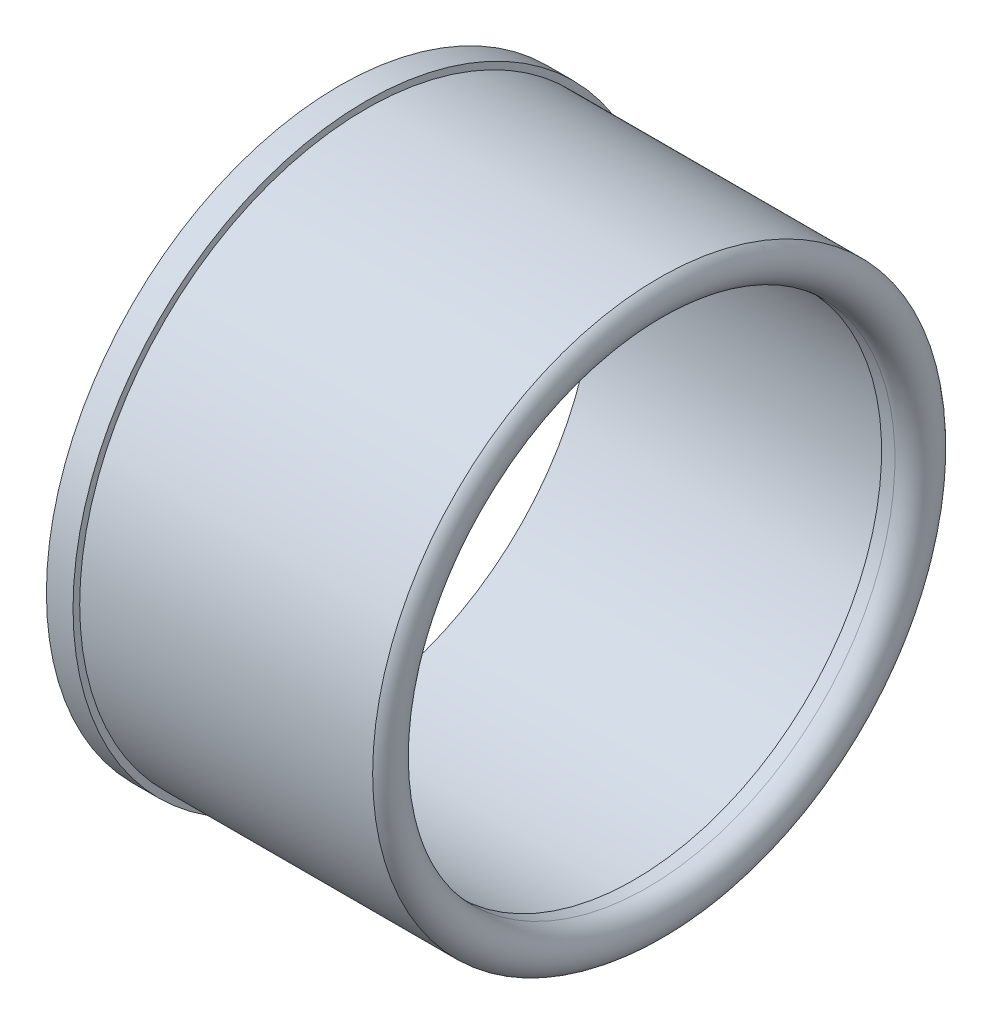
from build123d import *


with BuildPart() as part:
    # Sketch1 → Revolve1 (revolve)
    with BuildSketch(Plane(origin=(0, 0, 0), x_dir=(-1, 0, 0), z_dir=(0, 0, -1)), mode=Mode.PRIVATE) as revolve1_sk:
        with BuildLine():
            Line((-11.972812665, 0.766736765), (-11.972812665, 1.016736765))
            Line((-11.972812665, 1.016736765), (-0.912123334, 1.016736765))
            Line((-0.912123334, 1.016736765), (-0.912123334, 2.466736765))
            Line((-0.912123334, 2.466736765), (-1.912123334, 2.466736765))
            Line((-1.912123334, 2.466736765), (-1.912123334, 2.216736765))
            Line((-1.912123334, 2.216736765), (-12.912123334, 2.216736765))
            ThreePointArc((-12.912123334, 2.216736765), (-13.230357031, 1.328770979), (-12.472812665, 0.766736765))
            Line((-12.472812665, 0.766736765), (-11.972812665, 0.766736765))
        make_face()
    revolve(revolve1_sk.sketch.rotate(Axis((12.175741694, -8.533263235, 0), (-1, 0, 0)), 270), axis=Axis((12.175741694, -8.533263235, 0), (-1, 0, 0)))


solid = part.part
